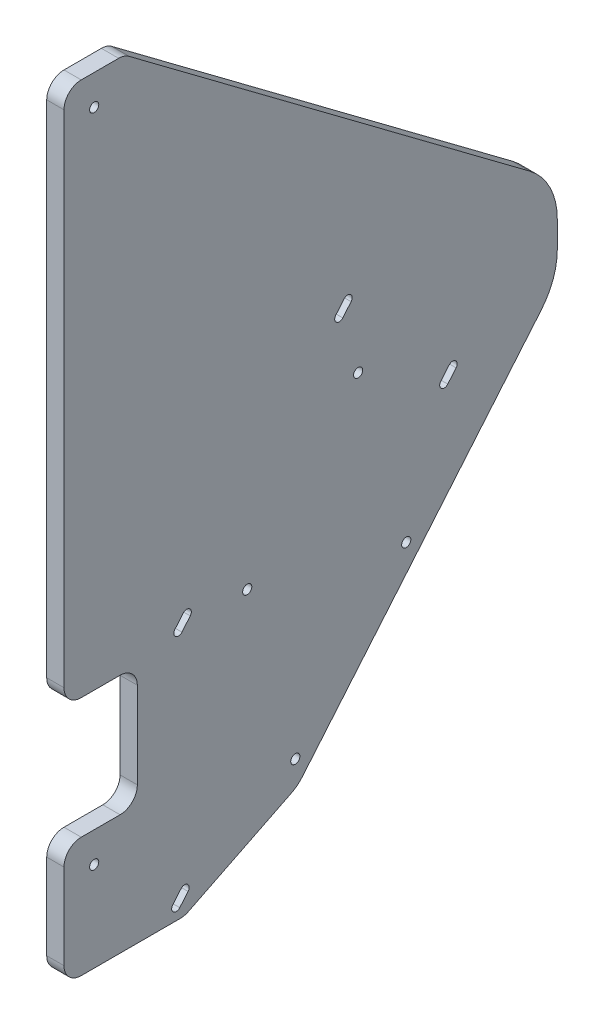
from build123d import *

# Parameters (mm, degrees)
SKETCH1_R           = 3.3734375
BOSS_EXTRUDE1_DEPTH = 12.7


with BuildPart() as part:
    # Sketch1 → Boss-Extrude1 (new body)
    with BuildSketch(Plane(origin=(0, 0, 0), x_dir=(0, 0, -1), z_dir=(1, 0, 0))):
        with BuildLine():
            Line((0, -12.7), (0, -381))
            ThreePointArc((0, -381), (3.719743879, -389.980256121), (12.7, -393.7))
            Line((12.7, -393.7), (41.275, -393.7))
            ThreePointArc((41.275, -393.7), (50.255256121, -397.419743879), (53.975, -406.4))
            Line((53.975, -406.4), (53.975, -469.9))
            ThreePointArc((53.975, -469.9), (50.255256121, -478.880256121), (41.275, -482.6))
            Line((41.275, -482.6), (12.7, -482.6))
            ThreePointArc((12.7, -482.6), (3.719743879, -486.319743879), (0, -495.3))
            Line((0, -495.3), (0, -558.1424575))
            ThreePointArc((0, -558.1424575), (3.719743879, -567.122713621), (12.7, -570.8424575))
            Line((12.7, -570.8424575), (85.67674, -570.8424575))
            ThreePointArc((85.67674, -570.8424575), (88.621267556, -570.501864059), (91.410289955, -569.498071015))
            Line((91.410289955, -569.498071015), (167.095255646, -531.940375361))
            ThreePointArc((167.095255646, -531.940375361), (171.599093022, -529.093805409), (175.425396365, -525.386122262))
            Line((175.425396365, -525.386122262), (180.108605599, -519.804919463))
            Line((180.108605599, -519.804919463), (261.742877776, -422.517481393))
            Line((261.742877776, -422.517481393), (351.116781651, -316.006356758))
            ThreePointArc((351.116781651, -316.006356758), (359.938169615, -300.727331458), (363.001806424, -283.352647887))
            Line((363.001806424, -283.352647887), (363.001806424, -263.778902144))
            ThreePointArc((363.001806424, -263.778902144), (357.625647598, -241.034349984), (342.635087803, -223.103905101))
            Line((342.635087803, -223.103905101), (47.83309284, -2.531250739))
            ThreePointArc((47.83309284, -2.531250739), (44.233942259, -0.649416703), (40.224772495, 0))
            Line((40.224772495, 0), (12.7, 0))
            ThreePointArc((12.7, 0), (3.719743879, -3.719743879), (0, -12.7))
        make_face()
        with Locations((22.225, -22.225)):
            Circle(SKETCH1_R, mode=Mode.SUBTRACT)
        with Locations((22.225, -504.825)):
            Circle(SKETCH1_R, mode=Mode.SUBTRACT)
        with Locations((216.464615836, -288.472417571)):
            Circle(SKETCH1_R, mode=Mode.SUBTRACT)
        with Locations((134.830886903, -385.759530517)):
            Circle(SKETCH1_R, mode=Mode.SUBTRACT)
        with Locations((170.22785017, -511.513938695)):
            Circle(SKETCH1_R, mode=Mode.SUBTRACT)
        with Locations((251.862122347, -414.226500625)):
            Circle(SKETCH1_R, mode=Mode.SUBTRACT)
        with BuildLine():
            Line((81.631459634, -384.638877782), (87.754018145, -377.342309939))
            ThreePointArc((87.754018145, -377.342309939), (92.506625395, -376.926514968), (92.922420366, -381.679122218))
            Line((92.922420366, -381.679122218), (86.799861855, -388.975690061))
            ThreePointArc((86.799861855, -388.975690061), (82.047254605, -389.391485032), (81.631459634, -384.638877782))
        make_face(mode=Mode.SUBTRACT)
        with BuildLine():
            Line((211.291500366, -240.612602218), (205.168941855, -247.909170061))
            ThreePointArc((205.168941855, -247.909170061), (200.416334605, -248.324965032), (200.000539634, -243.572357782))
            Line((200.000539634, -243.572357782), (206.123098145, -236.275789939))
            ThreePointArc((206.123098145, -236.275789939), (210.875705395, -235.859994968), (211.291500366, -240.612602218))
        make_face(mode=Mode.SUBTRACT)
        with BuildLine():
            Line((288.55068278, -321.417631427), (282.428112367, -328.714189282))
            ThreePointArc((282.428112367, -328.714189282), (277.675504439, -329.129976501), (277.25971722, -324.377368573))
            Line((277.25971722, -324.377368573), (283.382287633, -317.080810718))
            ThreePointArc((283.382287633, -317.080810718), (288.134895561, -316.665023499), (288.55068278, -321.417631427))
        make_face(mode=Mode.SUBTRACT)
        with BuildLine():
            Line((80.03125722, -559.423888573), (86.153827633, -552.127330718))
            ThreePointArc((86.153827633, -552.127330718), (90.906435561, -551.711543499), (91.32222278, -556.464151427))
            Line((91.32222278, -556.464151427), (85.199652367, -563.760709282))
            ThreePointArc((85.199652367, -563.760709282), (80.447044439, -564.176496501), (80.03125722, -559.423888573))
        make_face(mode=Mode.SUBTRACT)
    extrude(amount=BOSS_EXTRUDE1_DEPTH)


solid = part.part
